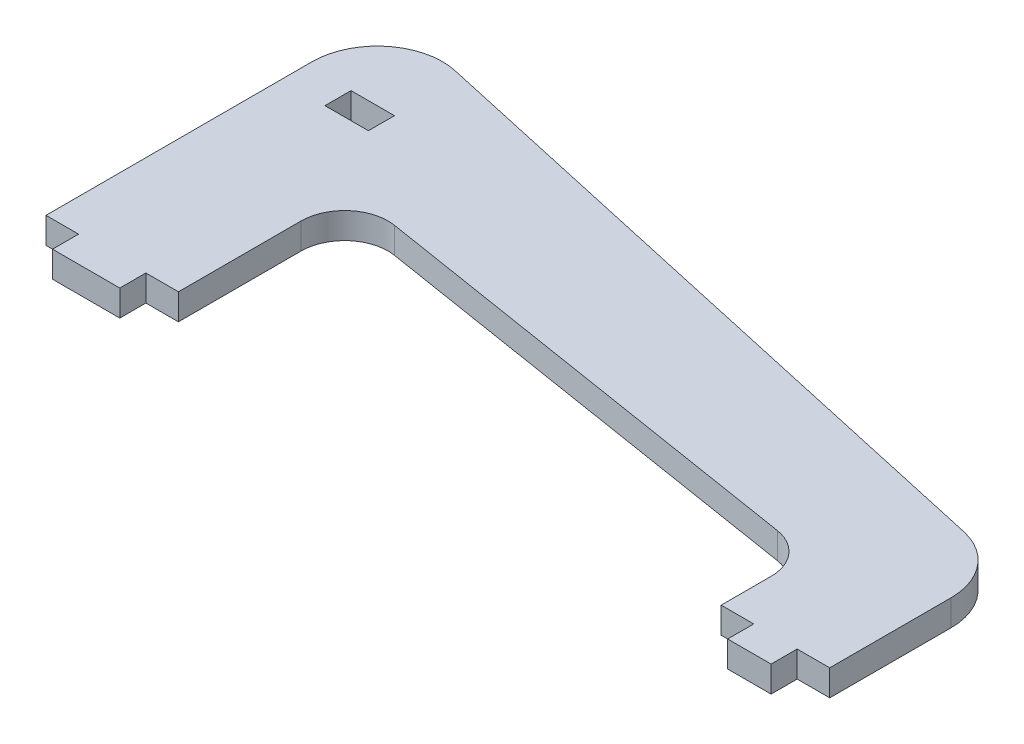
from build123d import *

# Parameters (mm, degrees)
SKETCH1_W           = 10
SKETCH1_H           = 6
BOSS_EXTRUDE1_DEPTH = 6


with BuildPart() as part:
    # Sketch1 → Boss-Extrude1 (new body)
    with BuildSketch(Plane(origin=(0, 0, 0), x_dir=(1, 0, 0), z_dir=(0, 1, 0))):
        with BuildLine():
            Line((0, 9.722175855), (-7.5, 9.722175855))
            Line((-7.5, 9.722175855), (-7.5, 21.194984734))
            ThreePointArc((-7.5, 21.194984734), (-9.890826257, 27.683472612), (-15.920094989, 31.069391053))
            Line((-15.920094989, 31.069391053), (-120.920094989, 47.869391053))
            ThreePointArc((-120.920094989, 47.869391053), (-128.988487878, 45.604158477), (-132.5, 37.994984734))
            Line((-132.5, 37.994984734), (-132.5, 9.722175855))
            Line((-132.5, 9.722175855), (-140, 9.722175855))
            Line((-140, 9.722175855), (-140, 3.722175855))
            Line((-140, 3.722175855), (-155.5, 3.722175855))
            Line((-155.5, 3.722175855), (-155.5, 9.722175855))
            Line((-155.5, 9.722175855), (-163, 9.722175855))
            Line((-163, 9.722175855), (-163, 71.03416911))
            ThreePointArc((-163, 71.03416911), (-157.389342775, 82.732042518), (-144.754634366, 85.678881532))
            Line((-144.754634366, 85.678881532), (5.745365634, 52.327080978))
            ThreePointArc((5.745365634, 52.327080978), (14.197873407, 47.071711331), (17.5, 37.682368556))
            Line((17.5, 37.682368556), (17.5, 9.722175855))
            Line((17.5, 9.722175855), (10, 9.722175855))
            Line((10, 9.722175855), (10, 3.722175855))
            Line((10, 3.722175855), (0, 3.722175855))
            Line((0, 3.722175855), (0, 9.722175855))
        make_face()
        with Locations((-147.75, 66.722175855)):
            Rectangle(SKETCH1_W, SKETCH1_H, mode=Mode.SUBTRACT)
    extrude(amount=BOSS_EXTRUDE1_DEPTH)


solid = part.part
